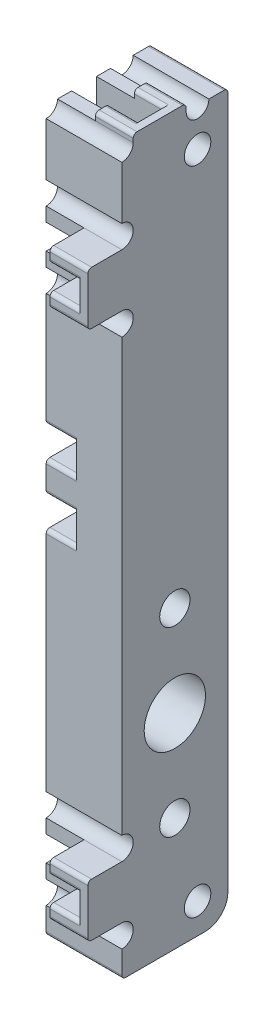
from build123d import *

# Parameters (mm, degrees)
BOSS_EXTRUDE3_DEPTH = 10
SKETCH19_R          = 2
SKETCH19_R_2        = 4.05
CUT_EXTRUDE13_DEPTH = 97.545326143
SKETCH24_R          = 1.75
CUT_EXTRUDE17_DEPTH = 10
SKETCH30_W          = 4.5
SKETCH30_H          = 7
SKETCH30_W_2        = 7
SKETCH30_H_2        = 1
BOSS_EXTRUDE4_DEPTH = 5
CUT_EXTRUDE19_DEPTH = 9
CUT_EXTRUDE21_DEPTH = 4
SKETCH31_R          = 1.5
CUT_EXTRUDE24_DEPTH = 97.545326143
SKETCH29_R          = 2
CUT_EXTRUDE23_DEPTH = 2
FILLET2_R           = 0.5
FILLET1_R           = 3


with BuildPart() as part:
    # Sketch17 → Boss-Extrude3 (new body)
    with BuildSketch(Plane(origin=(0, 0, 0), x_dir=(0, 0, -1), z_dir=(1, 0, 0))):
        Polygon((14, -60), (14, -95), (0, -95), (0, 0), (14, 0), (14, -45), align=None)
    extrude(amount=BOSS_EXTRUDE3_DEPTH)

    # Sketch19 → Cut-Extrude13 (cut, through all)
    with BuildSketch(Plane.ZY):
        with Locations((-7, -56)):
            Circle(SKETCH19_R)
        with Locations((-7, -68)):
            Circle(SKETCH19_R_2)
        with Locations((-7, -80)):
            Circle(SKETCH19_R)
    extrude(amount=-CUT_EXTRUDE13_DEPTH, mode=Mode.SUBTRACT)

    # Sketch24 → Cut-Extrude17 (cut)
    with BuildSketch(Plane.ZY):
        with Locations((-10, -5)):
            Circle(SKETCH24_R)
        with Locations((-10, -91)):
            Circle(SKETCH24_R)
    extrude(amount=-CUT_EXTRUDE17_DEPTH, mode=Mode.SUBTRACT)

    # Sketch30 → Boss-Extrude4 (add)
    with BuildSketch(Plane(origin=(10, 0, 0), x_dir=(0, 0, -1), z_dir=(1, 0, 0))):
        with Locations((-2.25, -15)):
            Rectangle(SKETCH30_W, SKETCH30_H)
        with Locations((-2.25, -85)):
            Rectangle(SKETCH30_W, SKETCH30_H)
        with Locations((5, 0.5)):
            Rectangle(SKETCH30_W_2, SKETCH30_H_2)
    extrude(amount=-BOSS_EXTRUDE4_DEPTH)

    # Sketch26 → Cut-Extrude19 (cut)
    with BuildSketch(Plane.ZY):
        with BuildLine():
            Line((-7, -13.35), (7, -13.35))
            ThreePointArc((7, -13.35), (8.65, -15), (7, -16.65))
            Line((7, -16.65), (-7, -16.65))
            ThreePointArc((-7, -16.65), (-8.65, -15), (-7, -13.35))
        make_face()
        with BuildLine():
            Line((-7, -83.35), (7, -83.35))
            ThreePointArc((7, -83.35), (8.65, -85), (7, -86.65))
            Line((7, -86.65), (-7, -86.65))
            ThreePointArc((-7, -86.65), (-8.65, -85), (-7, -83.35))
        make_face()
        with BuildLine():
            Line((-3.35, 8), (-3.35, -8))
            ThreePointArc((-3.35, -8), (-5, -9.65), (-6.65, -8))
            Line((-6.65, -8), (-6.65, 8))
            ThreePointArc((-6.65, 8), (-5, 9.65), (-3.35, 8))
        make_face()
    extrude(amount=-CUT_EXTRUDE19_DEPTH, mode=Mode.SUBTRACT)

    # Sketch27 → Cut-Extrude21 (cut)
    with BuildSketch(Plane.ZY):
        with BuildLine():
            Line((-22.181406925, -44.5), (2.318593075, -44.5))
            ThreePointArc((2.318593075, -44.5), (2.672146466, -44.646446609), (2.818593075, -45))
            Line((2.818593075, -45), (2.818593075, -48))
            ThreePointArc((2.818593075, -48), (2.672146466, -48.353553391), (2.318593075, -48.5))
            Line((2.318593075, -48.5), (-22.181406925, -48.5))
            Line((-22.181406925, -48.5), (-22.181406925, -44.5))
        make_face()
        with BuildLine():
            Line((-22.181406925, -36.5), (2.74769439, -36.5))
            ThreePointArc((2.74769439, -36.5), (2.783233621, -36.501264636), (2.818593075, -36.505052148))
            Line((2.818593075, -36.505052148), (2.818593075, -39.642901183))
            ThreePointArc((2.818593075, -39.642901183), (2.931519183, -40.189011364), (2.468621026, -40.5))
            Line((2.468621026, -40.5), (-22.181406925, -40.5))
            Line((-22.181406925, -40.5), (-22.181406925, -36.5))
        make_face()
    extrude(amount=-CUT_EXTRUDE21_DEPTH, mode=Mode.SUBTRACT)

    # Sketch31 → Cut-Extrude24 (cut, through all)
    with BuildSketch(Plane(origin=(10, 0, 0), x_dir=(0, 0, -1), z_dir=(1, 0, 0))):
        with Locations((0, -90)):
            Circle(SKETCH31_R)
        with Locations((0, -80)):
            Circle(SKETCH31_R)
        with Locations((0, -20)):
            Circle(SKETCH31_R)
        with Locations((0, -10)):
            Circle(SKETCH31_R)
        with Locations((10, 0)):
            Circle(SKETCH31_R)
        Circle(SKETCH31_R)
    extrude(amount=-CUT_EXTRUDE24_DEPTH, mode=Mode.SUBTRACT)

    # Sketch29 → Cut-Extrude23 (cut)
    with BuildSketch(Plane.ZY):
        with Locations((-10, -5)):
            Circle(SKETCH29_R)
        with Locations((-10, -91)):
            Circle(SKETCH29_R)
    extrude(amount=-CUT_EXTRUDE23_DEPTH, mode=Mode.SUBTRACT)

    # Fillet2
    fillet2_edges = [part.edges().sort_by_distance(p)[0] for p in [
        (2, -48.5, -14),
        (2, -44.5, -14),
        (2, -48.5, 0),
        (2, -44.5, 0),
        (5, 0, -14),
        (5, -95, 0),
        (2, -36.5, -14),
        (2, -40.5, -14),
        (2, -36.5, 0),
        (2, -40.5, 0),
        (7.5, 1, -8.5),
        (7, 1, -6.65),
        (7, 1, -3.35),
        (7.5, 1, -1.5),
        (7.5, -81.5, 4.5),
        (7, -83.35, 4.5),
        (7, -86.65, 4.5),
        (7.5, -88.5, 4.5),
        (7.5, -11.5, 4.5),
        (7.5, -18.5, 4.5),
        (7, -13.35, 4.5),
        (7, -16.65, 4.5),
    ]]
    fillet(fillet2_edges, radius=FILLET2_R)

    # Fillet1
    fillet1_edges = [part.edges().sort_by_distance(p)[0] for p in [
        (5, -95, -14),
    ]]
    fillet(fillet1_edges, radius=FILLET1_R)


solid = part.part
